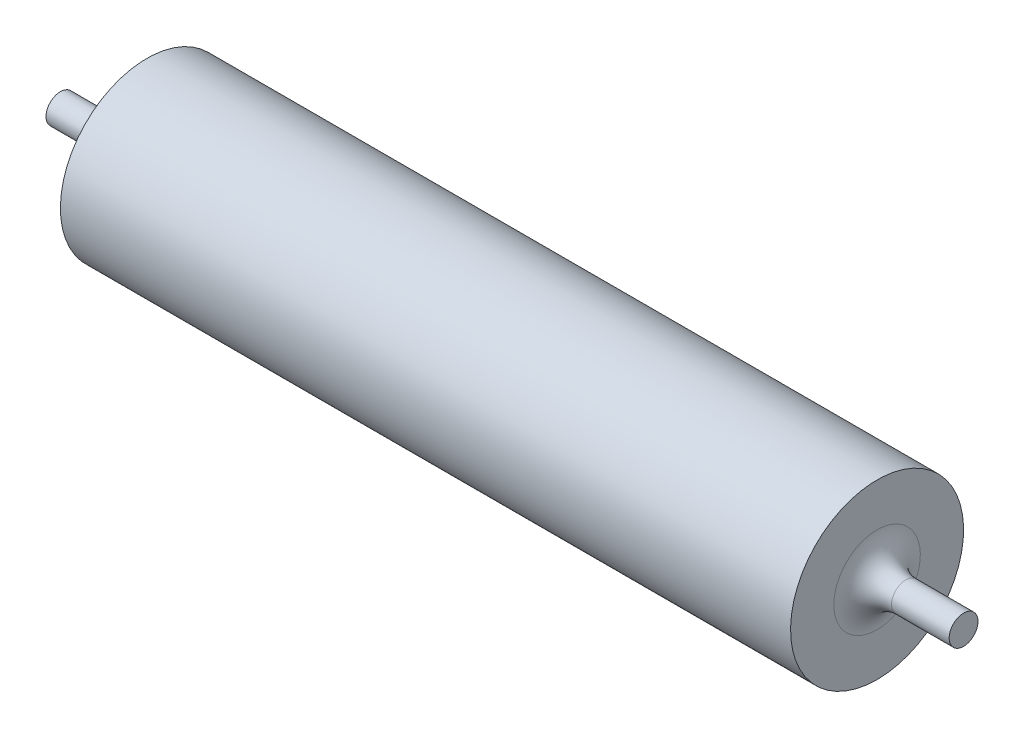
from build123d import *

# Parameters (mm, degrees)
CONG_1_R = 5


with BuildPart() as part:
    # Esquisse1 → Révolution1 (revolve)
    with BuildSketch(Plane.XY, mode=Mode.PRIVATE) as r_volution1_sk:
        Polygon((-78.3, 0), (-78.3, 2.5), (-63.3, 2.5), (-63.3, 15), (63.3, 15), (63.3, 2.5), (78.3, 2.5), (78.3, 0), align=None)
    revolve(r_volution1_sk.sketch.rotate(Axis((-78.3, 0, 0), (1, 0, 0)), 180), axis=Axis((-78.3, 0, 0), (1, 0, 0)))

    # Congé1
    cong_1_edges = [part.edges().sort_by_distance(p)[0] for p in [
        (-63.3, 2.5, 0),
        (63.3, 2.5, 0),
    ]]
    fillet(cong_1_edges, radius=CONG_1_R)


solid = part.part
